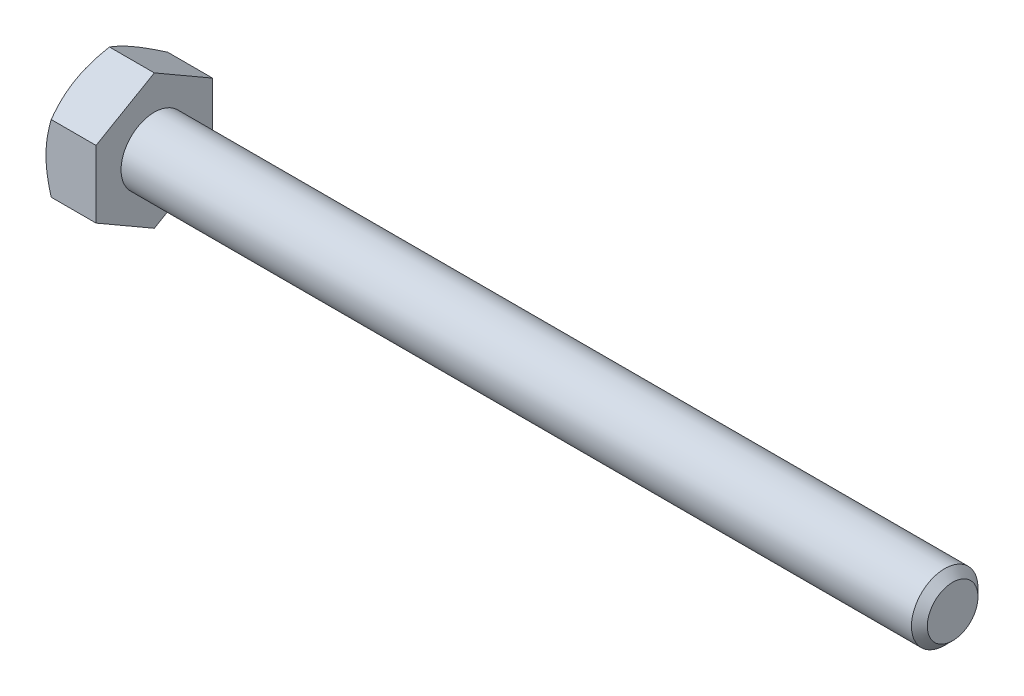
from build123d import *

# Parameters (mm, degrees)
BASEHEAD_DEPTH = 4.7752


with BuildPart() as part:
    # Sketch1 → BaseHead (new body)
    with BuildSketch(Plane(origin=(0, 0, 0), x_dir=(0, 0, -1), z_dir=(1, 0, 0))):
        Polygon((5.5626, 3.211568607), (5.5626, -3.211568607), (0, -6.423137215), (-5.5626, -3.211568607), (-5.5626, 3.211568607), (0, 6.423137215), align=None)
    extrude(amount=BASEHEAD_DEPTH)

    # BodySke → BaseBody (revolve)
    with BuildSketch(Plane.XY, mode=Mode.PRIVATE) as basebody_sk:
        Polygon((0, 0), (80.9752, 0), (80.9752, 2.41935), (80.21955, 3.175), (0, 3.175), align=None)
    revolve(basebody_sk.sketch.rotate(Axis((0, 0, 0), (1, 0, 0)), 90), axis=Axis((0, 0, 0), (1, 0, 0)))

    # Sketch3 → HeadChamfer (revolve, cut)
    with BuildSketch(Plane.XY):
        Polygon((0, 5.5626), (4.163005602, 12.773137215), (4.163005602, 19.123137215), (-12.7, 19.123137215), (-12.7, 5.5626), align=None)
    revolve(axis=Axis((0, 0, 0), (1, 0, 0)), mode=Mode.SUBTRACT)


solid = part.part
